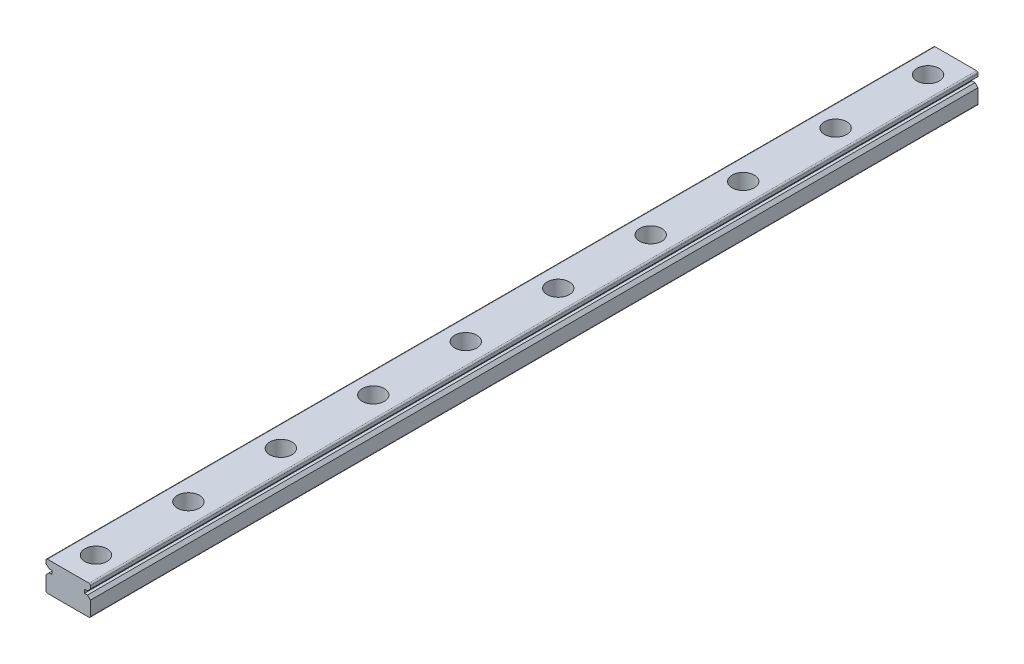
from build123d import *

# Parameters (mm, degrees)
BOSS_EXTRUDE1_DEPTH = 240
SKETCH2_R           = 3
CUT_EXTRUDE1_DEPTH  = 4.5
SKETCH3_R           = 1.75
CUT_EXTRUDE2_DEPTH  = 241.208242989


with BuildPart() as part:
    # Sketch1 → Boss-Extrude1 (new body)
    with BuildSketch(Plane.XY):
        with BuildLine():
            Line((-5.6, 4), (5.6, 4))
            ThreePointArc((5.6, 4), (5.882842712, 3.882842712), (6, 3.6))
            Line((6, 3.6), (6, 2.8))
            Line((6, 2.8), (5.2, 2))
            Line((5.2, 2), (4.4, 2))
            Line((4.4, 2), (4.4, 1))
            Line((4.4, 1), (5.2, 1))
            Line((5.2, 1), (6, 0.2))
            Line((6, 0.2), (6, -3.6))
            ThreePointArc((6, -3.6), (5.882842712, -3.882842712), (5.6, -4))
            Line((5.6, -4), (-5.6, -4))
            ThreePointArc((-5.6, -4), (-5.882842712, -3.882842712), (-6, -3.6))
            Line((-6, -3.6), (-6, 0.2))
            Line((-6, 0.2), (-5.2, 1))
            Line((-5.2, 1), (-4.4, 1))
            Line((-4.4, 1), (-4.4, 2))
            Line((-4.4, 2), (-5.2, 2))
            Line((-5.2, 2), (-6, 2.8))
            Line((-6, 2.8), (-6, 3.6))
            ThreePointArc((-6, 3.6), (-5.882842712, 3.882842712), (-5.6, 4))
        make_face()
    extrude(amount=BOSS_EXTRUDE1_DEPTH)

    # Sketch2 → Cut-Extrude1 (cut)
    with BuildSketch(Plane(origin=(0, 4, 0), x_dir=(1, 0, 0), z_dir=(0, 1, 0))):
        with Locations(Location((0, -232.5, 0), (0, 0, 270))):
            Circle(SKETCH2_R)
        with Locations(Location((0, -207.5, 0), (0, 0, 270))):
            Circle(SKETCH2_R)
        with Locations(Location((0, -182.5, 0), (0, 0, 270))):
            Circle(SKETCH2_R)
        with Locations(Location((0, -157.5, 0), (0, 0, 270))):
            Circle(SKETCH2_R)
        with Locations(Location((0, -132.5, 0), (0, 0, 270))):
            Circle(SKETCH2_R)
        with Locations(Location((0, -107.5, 0), (0, 0, 270))):
            Circle(SKETCH2_R)
        with Locations(Location((0, -82.5, 0), (0, 0, 270))):
            Circle(SKETCH2_R)
        with Locations(Location((0, -57.5, 0), (0, 0, 270))):
            Circle(SKETCH2_R)
        with Locations(Location((0, -32.5, 0), (0, 0, 270))):
            Circle(SKETCH2_R)
        with Locations(Location((0, -7.5, 0), (0, 0, 270))):
            Circle(SKETCH2_R)
        with Locations((0, 17.5)):
            Circle(SKETCH2_R)
        with Locations((0, 42.5)):
            Circle(SKETCH2_R)
        with Locations((0, 67.5)):
            Circle(SKETCH2_R)
        with Locations((0, 92.5)):
            Circle(SKETCH2_R)
        with Locations((0, 117.5)):
            Circle(SKETCH2_R)
        with Locations((0, 142.5)):
            Circle(SKETCH2_R)
        with Locations((0, 167.5)):
            Circle(SKETCH2_R)
        with Locations((0, 192.5)):
            Circle(SKETCH2_R)
    extrude(amount=-CUT_EXTRUDE1_DEPTH, mode=Mode.SUBTRACT)

    # Sketch3 → Cut-Extrude2 (cut, through all)
    with BuildSketch(Plane(origin=(0, 4, 0), x_dir=(1, 0, 0), z_dir=(0, 1, 0))):
        with Locations(Location((0, -232.5, 0), (0, 0, 270))):
            Circle(SKETCH3_R)
        with Locations(Location((0, -207.5, 0), (0, 0, 270))):
            Circle(SKETCH3_R)
        with Locations(Location((0, -182.5, 0), (0, 0, 270))):
            Circle(SKETCH3_R)
        with Locations(Location((0, -157.5, 0), (0, 0, 270))):
            Circle(SKETCH3_R)
        with Locations(Location((0, -132.5, 0), (0, 0, 270))):
            Circle(SKETCH3_R)
        with Locations(Location((0, -107.5, 0), (0, 0, 270))):
            Circle(SKETCH3_R)
        with Locations(Location((0, -82.5, 0), (0, 0, 270))):
            Circle(SKETCH3_R)
        with Locations(Location((0, -57.5, 0), (0, 0, 270))):
            Circle(SKETCH3_R)
        with Locations(Location((0, -32.5, 0), (0, 0, 270))):
            Circle(SKETCH3_R)
        with Locations(Location((0, -7.5, 0), (0, 0, 270))):
            Circle(SKETCH3_R)
        with Locations((0, 17.5)):
            Circle(SKETCH3_R)
        with Locations((0, 42.5)):
            Circle(SKETCH3_R)
        with Locations((0, 67.5)):
            Circle(SKETCH3_R)
        with Locations((0, 92.5)):
            Circle(SKETCH3_R)
        with Locations((0, 117.5)):
            Circle(SKETCH3_R)
    extrude(amount=-CUT_EXTRUDE2_DEPTH, mode=Mode.SUBTRACT)


solid = part.part
